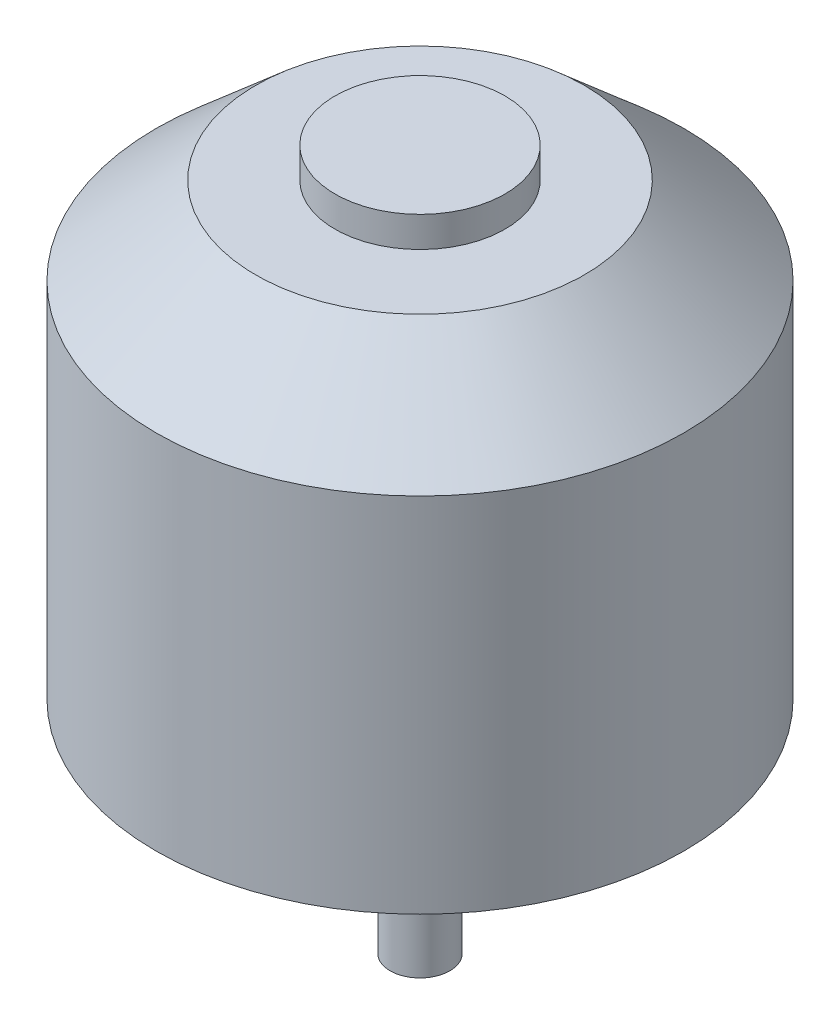
from build123d import *

# Parameters (mm, degrees)
SKETCH2_R                           = 1.58
BOSS_EXTRUDE1_DEPTH                 = 11.684
M3X0_5_BOTTOMING_TAPPED_HOLE1_D     = 2.5
M3X0_5_BOTTOMING_TAPPED_HOLE1_DEPTH = 3.175
M3X0_5_BOTTOMING_TAPPED_HOLE1_TIP   = 0.751075774


with BuildPart() as part:
    # Sketch1 → Revolve1 (revolve)
    with BuildSketch(Plane.XY, mode=Mode.PRIVATE) as revolve1_sk:
        Polygon((0, 0), (13.97, 0), (13.97, 19.177), (8.6995, 23.7871), (4.50215, 23.7871), (4.50215, 25.4), (0, 25.4), align=None)
    revolve(revolve1_sk.sketch.rotate(Axis((0, 0, 0), (0, 1, 0)), 90), axis=Axis((0, 0, 0), (0, 1, 0)))

    # Sketch2 → Boss-Extrude1 (add)
    with BuildSketch(Plane.XZ):
        with Locations(Location((0, 0, 0), (0, 0, 270))):
            Circle(SKETCH2_R)
    extrude(amount=BOSS_EXTRUDE1_DEPTH)

    # M3x0.5 Bottoming Tapped Hole1
    with Locations(Plane(origin=(0, 0, 0), x_dir=(-1, 0, 0), z_dir=(0, -1, 0))):
        with Locations((-8, 0), (8, 0), (0, -9.5), (0, 9.5)):
            Hole(M3X0_5_BOTTOMING_TAPPED_HOLE1_D / 2, depth=M3X0_5_BOTTOMING_TAPPED_HOLE1_DEPTH)
            with Locations((0, 0, -(M3X0_5_BOTTOMING_TAPPED_HOLE1_DEPTH + M3X0_5_BOTTOMING_TAPPED_HOLE1_TIP / 2))):  # 118° drill point
                Cone(0, M3X0_5_BOTTOMING_TAPPED_HOLE1_D / 2, M3X0_5_BOTTOMING_TAPPED_HOLE1_TIP, mode=Mode.SUBTRACT)


solid = part.part
